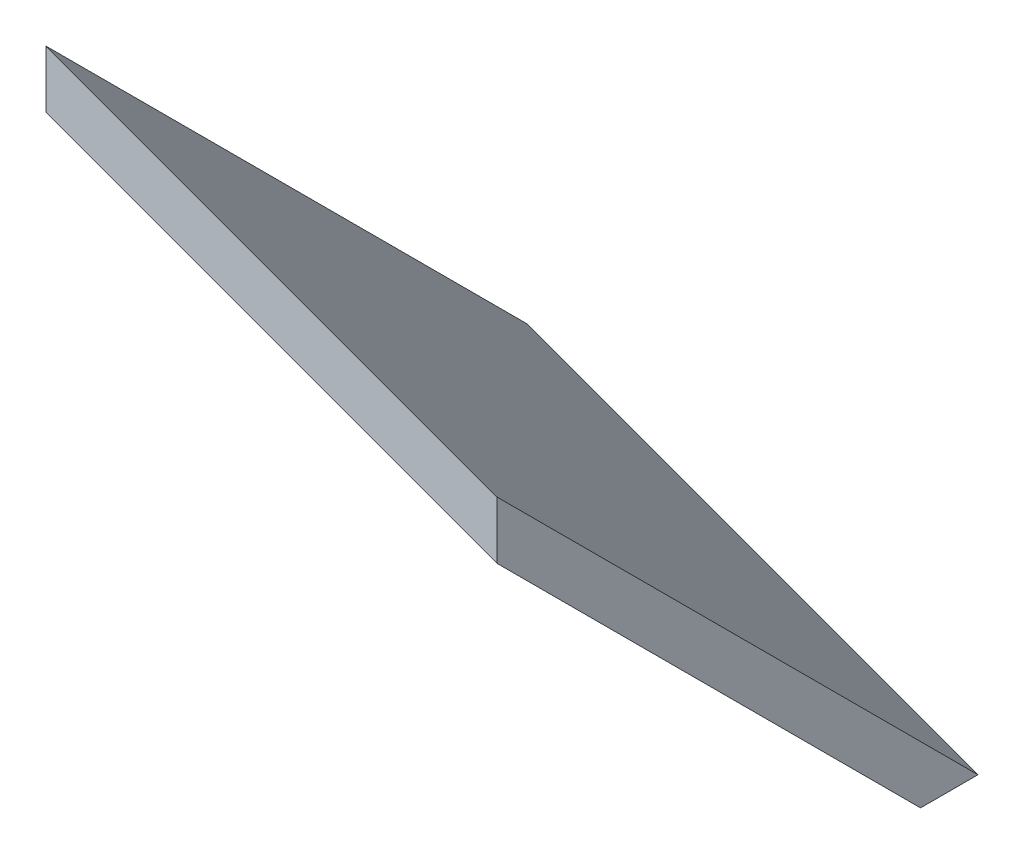
from build123d import *


with BuildPart() as part:
    # Sweep1: sweep along a path in Sketch2
    with BuildLine(Plane(origin=(0, 0, 0), x_dir=(1, 0, 0), z_dir=(0, 1, 0))) as sweep1_path:
        Line((0, 129.8), (-166.139242122, 174.316875758))
    # Sketch1 → Sweep1 (sweep)
    with BuildSketch(Plane(origin=(0, 0, 0), x_dir=(0, 0, -1), z_dir=(1, 0, 0))):
        Polygon((0, 114.3), (114.3, 0), (129.8, 0), (0, 129.8), align=None)
    sweep(path=sweep1_path.line)


solid = part.part
